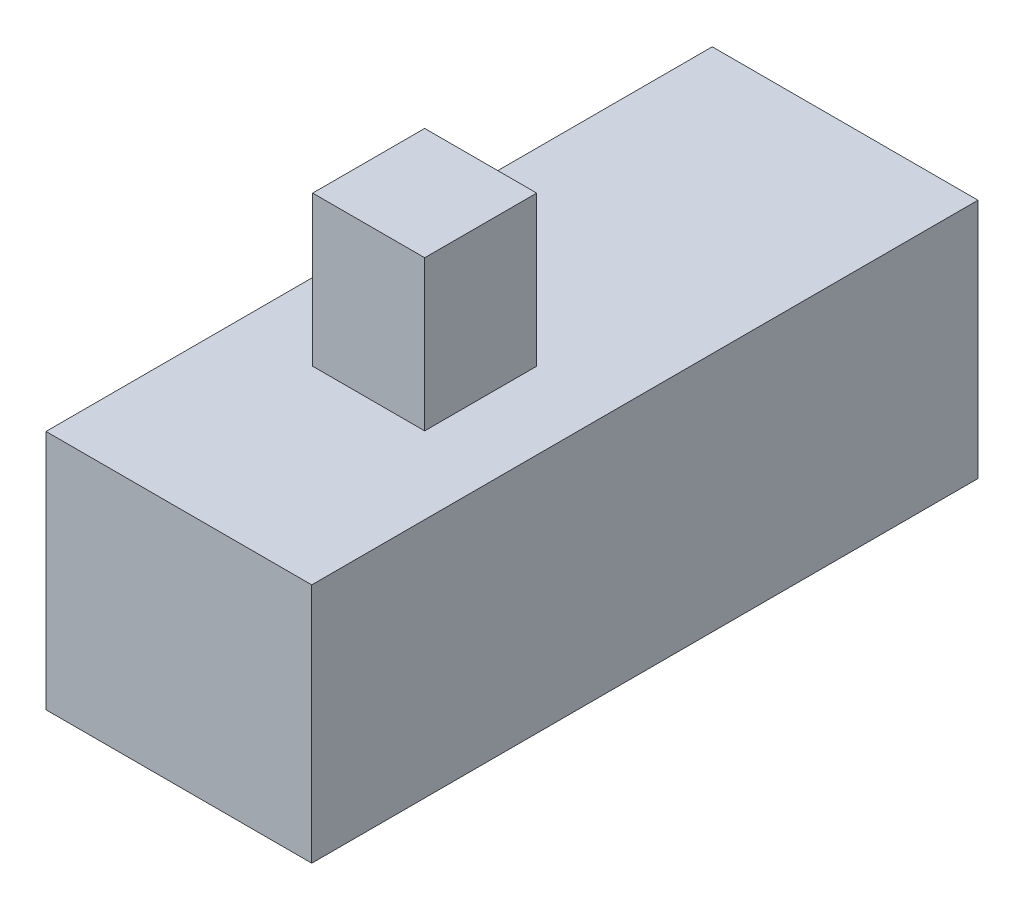
from build123d import *

# Parameters (mm, degrees)
SKETCH1_W           = 3.556
SKETCH1_H           = 8.9154
BOSS_EXTRUDE1_DEPTH = 3.2258
SKETCH2_W           = 1.4986
SKETCH2_H           = 1.4986
BOSS_EXTRUDE2_DEPTH = 2.0066


with BuildPart() as part:
    # Sketch1 → Boss-Extrude1 (new body)
    with BuildSketch(Plane(origin=(0, 0, 0), x_dir=(1, 0, 0), z_dir=(0, 1, 0))):
        with Locations((-18.128075232, 39.791346752)):
            Rectangle(SKETCH1_W, SKETCH1_H)
    extrude(amount=BOSS_EXTRUDE1_DEPTH)

    # Sketch2 → Boss-Extrude2 (add)
    with BuildSketch(Plane(origin=(0, 3.2258, 0), x_dir=(1, 0, 0), z_dir=(0, 1, 0))):
        with Locations((-18.128075232, 38.622946752)):
            Rectangle(SKETCH2_W, SKETCH2_H)
    extrude(amount=BOSS_EXTRUDE2_DEPTH)


solid = part.part
